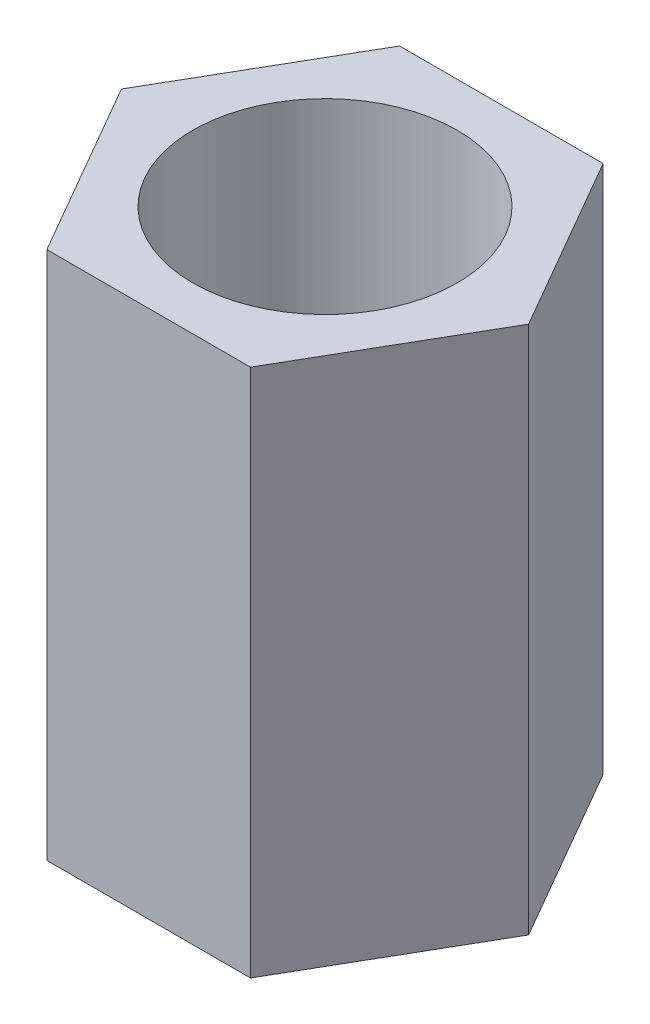
from build123d import *

# Parameters (mm, degrees)
CROQUIS1_R              = 1.5
SALIENTE_EXTRUIR1_DEPTH = 3
SCALE1_SCALE            = 0.888888889


with BuildPart() as part:
    # Croquis1 → Saliente-Extruir1 (new, symmetric)
    with BuildSketch(Plane(origin=(0, 0, 0), x_dir=(1, 0, 0), z_dir=(0, 1, 0))):
        Polygon((1.154700538, 2), (-1.154700538, 2), (-2.309401077, 0), (-1.154700538, -2), (1.154700538, -2), (2.309401077, 0), align=None)
        with Locations(Location((0, 0, 0), (0, 0, 270))):
            Circle(CROQUIS1_R, mode=Mode.SUBTRACT)
    extrude(amount=SALIENTE_EXTRUIR1_DEPTH, both=True)


with BuildPart() as part_1:
    # Scale1: scaled about (0, 0, 0)
    add(part.part.scale(SCALE1_SCALE))


solid = part_1.part
